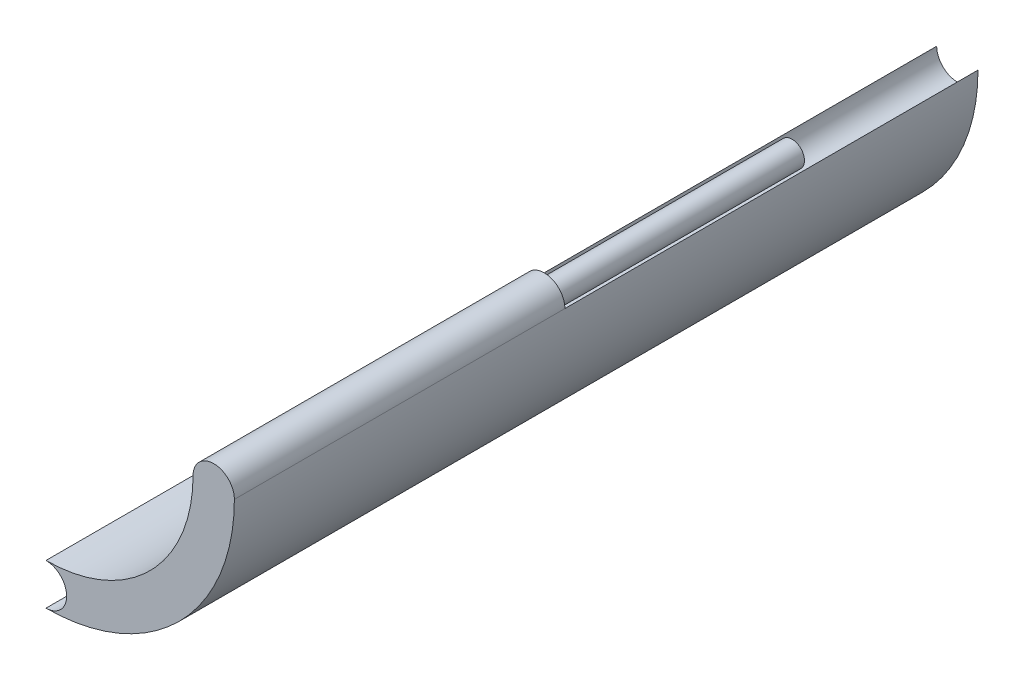
from build123d import *

# Parameters (mm, degrees)
BOSS_EXTRU_1_DEPTH = 450
ESQUISSE1_3_R      = 7.5
BOSS_EXTRU_2_DEPTH = 350
ESQUISSE1_4_R      = 7.5
BOSS_EXTRU_3_DEPTH = 200


with BuildPart() as part:
    # Esquisse1 → Boss.-Extru.1 (new body)
    with BuildSketch(Plane.XY):
        with BuildLine():
            ThreePointArc((114, 0), (101.5, -12.5), (89, 0))
            ThreePointArc((89, 0), (62.932503523, -62.932503528), (-6e-09, -89))
            ThreePointArc((-6e-09, -89), (8.838834763, -92.661165233), (12.5, -101.5))
            ThreePointArc((12.5, -101.5), (8.838834791, -110.338834739), (7.4e-08, -114))
            ThreePointArc((7.4e-08, -114), (80.610173081, -80.610173029), (114, 0))
        make_face()
    extrude(amount=-BOSS_EXTRU_1_DEPTH)



with BuildPart() as body_2:
    # Esquisse1<3> → Boss.-Extru.2 (new body)
    with BuildSketch(Plane.XY):
        with Locations((101.5, 0)):
            Circle(ESQUISSE1_3_R)
    extrude(amount=-BOSS_EXTRU_2_DEPTH)


with BuildPart() as part_1:
    add(part.part)

    add(body_2.part)  # Boss.-Extru.3 merges body 2
    # Esquisse1<4> → Boss.-Extru.3 (add)
    with BuildSketch(Plane.XY):
        with BuildLine():
            ThreePointArc((114, 0), (101.5, 12.5), (89, 0))
            ThreePointArc((89, 0), (101.5, -12.5), (114, 0))
        make_face()
        with Locations((101.5, 0)):
            Circle(ESQUISSE1_4_R, mode=Mode.SUBTRACT)
    extrude(amount=-BOSS_EXTRU_3_DEPTH)


solid = part_1.part
